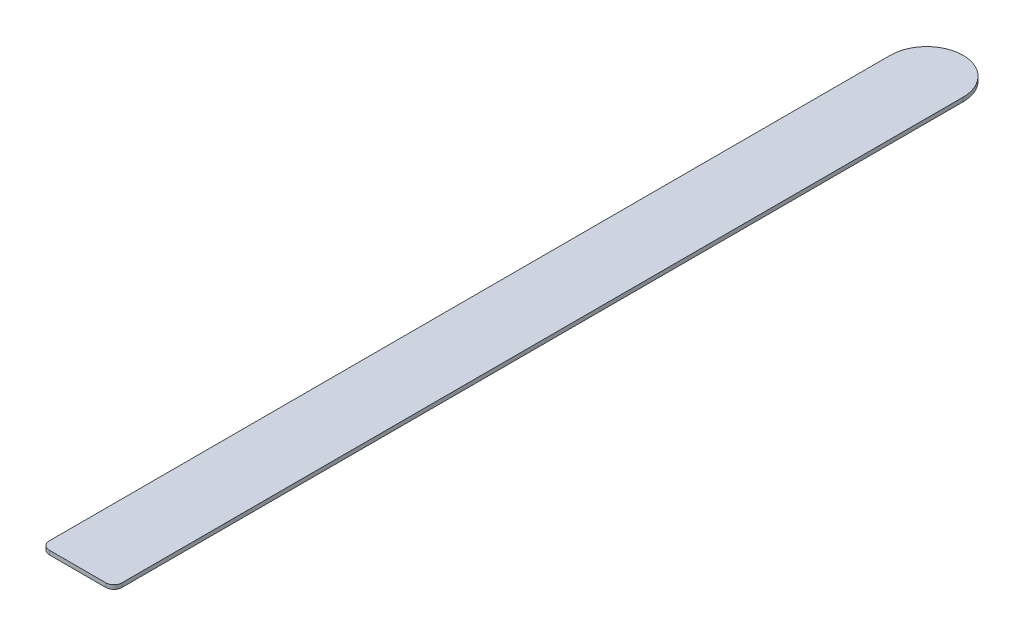
from build123d import *

# Parameters (mm, degrees)
SKETCH1_R           = 44.7
BOSS_EXTRUDE1_DEPTH = 5
FILLET1_R           = 10


with BuildPart() as part:
    # Sketch1 → Boss-Extrude1 (new body)
    with BuildSketch(Plane(origin=(0, 0, 0), x_dir=(1, 0, 0), z_dir=(0, 1, 0))):
        with BuildLine():
            ThreePointArc((44.7, 0), (0, -44.7), (-44.7, 0))
            Line((-44.7, 0), (-44.7, -1044.7))
            Line((-44.7, -1044.7), (44.7, -1044.7))
            Line((44.7, -1044.7), (44.7, 0))
        make_face()
        Circle(SKETCH1_R)
    extrude(amount=BOSS_EXTRUDE1_DEPTH)

    # Fillet1
    fillet1_edges = [part.edges().sort_by_distance(p)[0] for p in [
        (44.7, 2.5, 1044.7),
        (-44.7, 2.5, 1044.7),
    ]]
    fillet(fillet1_edges, radius=FILLET1_R)


solid = part.part
